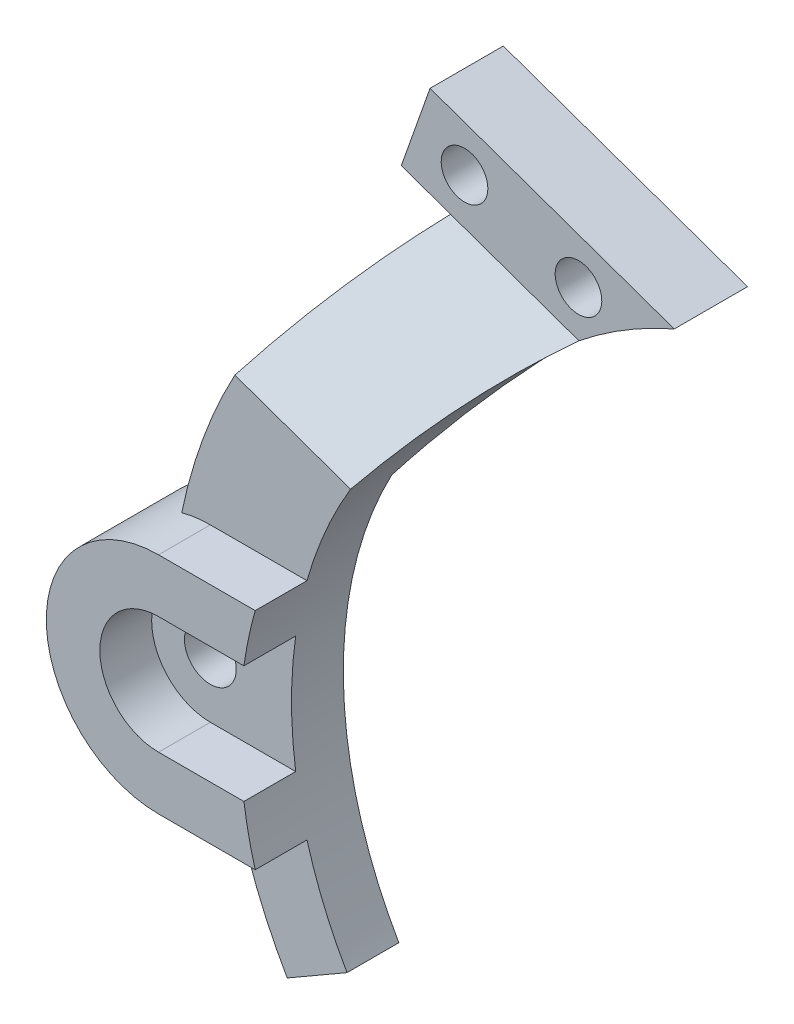
from build123d import *

# Parameters (mm, degrees)
RESSALTO_EXTRUS_O1_DEPTH   = 15
ESBO_O1_3_R                = 1.5
RESSALTO_EXTRUS_O2_DEPTH   = 12
ESBO_O1_4_R                = 1.35
RESSALTO_EXTRUS_O3_DEPTH   = 12
CORTE_EXTRUS_O1_DEPTH      = 38.624816903
CORTE_EXTRUS_O1_DEPTH_BACK = 38.624816903


with BuildPart() as part:
    # Esboço1 → Ressalto-extrusão1 (new body)
    with BuildSketch(Plane.XY):
        with BuildLine():
            ThreePointArc((0, -3.4), (-3.4, 0), (0, 3.4))
            Line((0, 3.4), (4.942053961, 3.4))
            ThreePointArc((4.942053961, 3.4), (5.218299225, 4.96081936), (5.596969896, 6.5))
            Line((5.596969896, 6.5), (0, 6.5))
            ThreePointArc((0, 6.5), (-0.834966341, 6.446148556), (-1.656097561, 6.285486526))
            ThreePointArc((-1.656097561, 6.285486526), (-6.446148556, -0.834966341), (0, -6.5))
            Line((0, -6.5), (1.464912337, -6.5))
            Line((1.464912337, -6.5), (5.596969896, -6.5))
            ThreePointArc((5.596969896, -6.5), (5.218299225, -4.96081936), (4.942053961, -3.4))
            Line((4.942053961, -3.4), (0, -3.4))
        make_face()
    extrude(amount=RESSALTO_EXTRUS_O1_DEPTH)

    # Esboço1<3> → Ressalto-extrusão2 (add)
    with BuildSketch(Plane.XY):
        with BuildLine():
            Line((4.942053961, 3.4), (0, 3.4))
            ThreePointArc((0, 3.4), (-3.4, 0), (0, -3.4))
            Line((0, -3.4), (4.942053961, -3.4))
            ThreePointArc((4.942053961, -3.4), (4.7, 0), (4.942053961, 3.4))
        make_face()
        Circle(ESBO_O1_3_R, mode=Mode.SUBTRACT)
    extrude(amount=RESSALTO_EXTRUS_O2_DEPTH)

    # Esboço1<4> → Ressalto-extrusão3 (add)
    # profile 1 of 2: a face of its own
    with BuildSketch(Plane.XY):
        with BuildLine():
            Line((0, 6.5), (5.596969896, 6.5))
            ThreePointArc((5.596969896, 6.5), (10.608614203, 15.770280909), (19.108336953, 22))
            Line((19.108336953, 22), (4.96620133, 27))
            Line((4.96620133, 27), (3.299534663, 22.285954792))
            Line((3.299534663, 22.285954792), (6.154368486, 21.276618614))
            ThreePointArc((6.154368486, 21.276618614), (1.207605686, 14.323695574), (-1.656097561, 6.285486526))
            ThreePointArc((-1.656097561, 6.285486526), (-0.834966341, 6.446148556), (0, 6.5))
        make_face()
        with Locations((6.961295121, 23.642977396)):
            Circle(ESBO_O1_4_R, mode=Mode.SUBTRACT)
        with Locations((13.560958412, 21.309644063)):
            Circle(ESBO_O1_4_R, mode=Mode.SUBTRACT)
    # profile 2 of 2: a face of its own
    with BuildSketch(Plane.XY):
        with BuildLine():
            ThreePointArc((7.915390309, -12), (6.584536367, -9.322353153), (5.596969896, -6.5))
            Line((5.596969896, -6.5), (1.464912337, -6.5))
            ThreePointArc((1.464912337, -6.5), (2.686390311, -10.358190524), (4.451288694, -14))
            Line((4.451288694, -14), (7.915390309, -12))
        make_face()
    extrude(amount=RESSALTO_EXTRUS_O3_DEPTH)

    # Esboço2 → Corte-extrusão1 (cut, two sides: drawn at the far end of the back side and taken through both)
    with BuildSketch(Plane(origin=(-4.070880192, 1.439273495, 0), x_dir=(0, 0, 1), z_dir=(-0.9428090415820632, 0.33333333333333404, 0)).offset(-CORTE_EXTRUS_O1_DEPTH_BACK)):
        Polygon((0, -11.715563684), (9, -11.715563684), (9, 13.111244566), (0, 22.111244566), align=None)
        Polygon((4.242640687, 27.111244566), (4.242640687, 22.111244566), (12, 14.353885253), (12, 27.111244566), align=None)
    extrude(amount=CORTE_EXTRUS_O1_DEPTH + CORTE_EXTRUS_O1_DEPTH_BACK, mode=Mode.SUBTRACT)


solid = part.part
